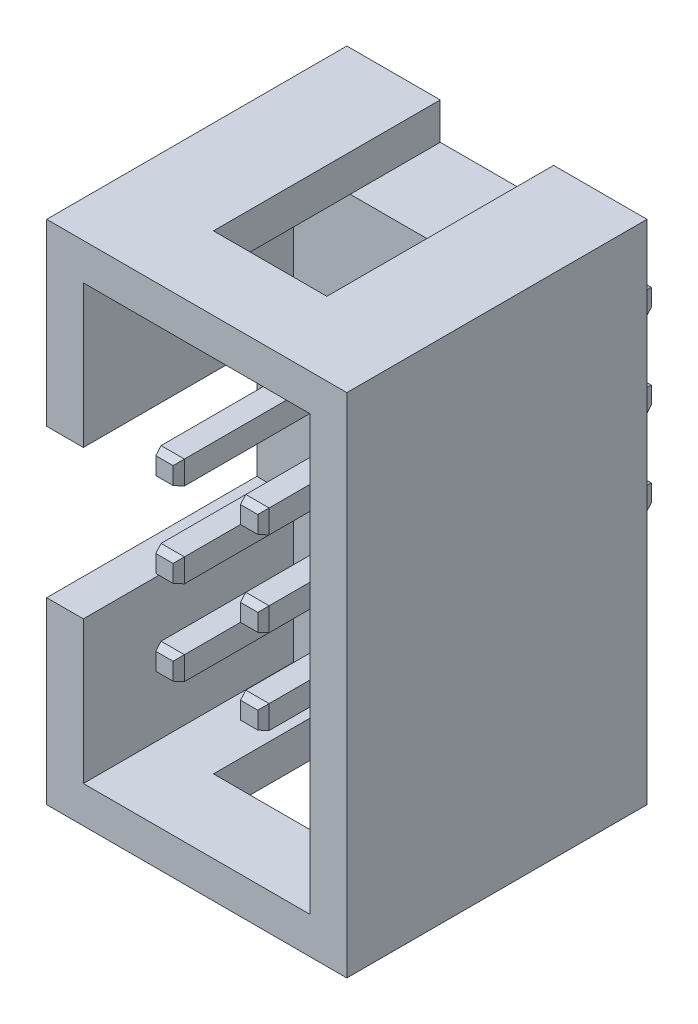
from build123d import *
from OCP.BRepFilletAPI import BRepFilletAPI_MakeChamfer

# Parameters (mm, degrees)
SKETCH1_W            = 9
SKETCH1_H            = 15.2
BOSS_EXTRUDE1_DEPTH  = 9
SKETCH2_W            = 6.8
SKETCH2_H            = 13
CUT_EXTRUDE1_DEPTH   = 6.3
SKETCH3_W            = 1.1
SKETCH3_H            = 4.45
CUT_EXTRUDE2_DEPTH   = 6.3
SKETCH4_W            = 3.4
SKETCH4_H            = 6.8
CUT_EXTRUDE3_DEPTH   = 1.1
BOSS_EXTRUDE2_START  = -5.8
SKETCH5_W            = 0.7
SKETCH5_H            = 0.7
BOSS_EXTRUDE2_DEPTH  = 11.8
LPATTERN1_COUNT      = 2
LPATTERN1_PITCH      = 2.54
LPATTERN1_COUNT_DIR2 = 3
LPATTERN1_PITCH_DIR2 = 2.54
CHAMFER1_SIZE        = 0.25
CHAMFER1_SIZE2       = 0.090992559


with BuildPart() as part:
    # Sketch1 → Boss-Extrude1 (new body)
    with BuildSketch(Plane.XY):
        Rectangle(SKETCH1_W, SKETCH1_H)
    extrude(amount=BOSS_EXTRUDE1_DEPTH)

    # Sketch2 → Cut-Extrude1 (cut)
    with BuildSketch(Plane.XY.offset(9)):
        Rectangle(SKETCH2_W, SKETCH2_H)
    extrude(amount=-CUT_EXTRUDE1_DEPTH, mode=Mode.SUBTRACT)

    # Sketch3 → Cut-Extrude2 (cut)
    with BuildSketch(Plane.XY.offset(9)):
        with Locations((-3.95, 0)):
            Rectangle(SKETCH3_W, SKETCH3_H)
    extrude(amount=-CUT_EXTRUDE2_DEPTH, mode=Mode.SUBTRACT)

    # Sketch4 → Cut-Extrude3 (cut)
    with BuildSketch(Plane.XZ.offset(7.6)):
        with Locations((0, 3.4)):
            Rectangle(SKETCH4_W, SKETCH4_H)
    cut_extrude3 = extrude(amount=-CUT_EXTRUDE3_DEPTH, mode=Mode.SUBTRACT)

    # Mirror1: Cut-Extrude3 across plane
    add(cut_extrude3.mirror(Plane.ZX), mode=Mode.SUBTRACT)

    # Sketch5 → Boss-Extrude2 (add)
    with BuildSketch(Plane.XY.offset(2.7).offset(BOSS_EXTRUDE2_START)):
        with Locations((-1.27, 2.54)):
            Rectangle(SKETCH5_W, SKETCH5_H)
    boss_extrude2 = extrude(amount=BOSS_EXTRUDE2_DEPTH)

    # LPattern1: Boss-Extrude2 2 × 3
    with Locations(*[(i * LPATTERN1_PITCH, -j * LPATTERN1_PITCH_DIR2, 0) for i in range(LPATTERN1_COUNT) for j in range(LPATTERN1_COUNT_DIR2) if (i, j) != (0, 0)]):
        add(boss_extrude2)

    # Chamfer1: one chamfer whose edges measure the first distance from different faces: ONE call of the kernel's chamfer builder (chamfer() names one face for all edges)
    chamfer1_edges_1 = [part.edges().sort_by_distance(p)[0] for p in [
        (-0.92, 0, -3.1),
    ]]
    chamfer1_side_1 = [part.faces().sort_by_distance(p)[0] for p in [
        (-0.92, 0, -1.55),
    ]]
    chamfer1_edges_2 = [part.edges().sort_by_distance(p)[0] for p in [
        (-1.27, -0.35, -3.1),
    ]]
    chamfer1_side_2 = [part.faces().sort_by_distance(p)[0] for p in [
        (-1.27, -0.35, -1.55),
    ]]
    chamfer1_edges_3 = [part.edges().sort_by_distance(p)[0] for p in [
        (-1.62, 0, -3.1),
    ]]
    chamfer1_side_3 = [part.faces().sort_by_distance(p)[0] for p in [
        (-1.62, 0, -1.55),
    ]]
    chamfer1_edges_4 = [part.edges().sort_by_distance(p)[0] for p in [
        (-1.27, 0.35, -3.1),
    ]]
    chamfer1_side_4 = [part.faces().sort_by_distance(p)[0] for p in [
        (-1.27, 0.35, -1.55),
    ]]
    chamfer1_edges_5 = [part.edges().sort_by_distance(p)[0] for p in [
        (-0.92, 0, 8.7),
    ]]
    chamfer1_side_5 = [part.faces().sort_by_distance(p)[0] for p in [
        (-0.92, 0, 5.7),
    ]]
    chamfer1_edges_6 = [part.edges().sort_by_distance(p)[0] for p in [
        (-1.27, 0.35, 8.7),
    ]]
    chamfer1_side_6 = [part.faces().sort_by_distance(p)[0] for p in [
        (-1.27, 0.35, 5.7),
    ]]
    chamfer1_edges_7 = [part.edges().sort_by_distance(p)[0] for p in [
        (-1.62, 0, 8.7),
    ]]
    chamfer1_side_7 = [part.faces().sort_by_distance(p)[0] for p in [
        (-1.62, 0, 5.7),
    ]]
    chamfer1_edges_8 = [part.edges().sort_by_distance(p)[0] for p in [
        (-1.27, -0.35, 8.7),
    ]]
    chamfer1_side_8 = [part.faces().sort_by_distance(p)[0] for p in [
        (-1.27, -0.35, 5.7),
    ]]
    chamfer1_edges_9 = [part.edges().sort_by_distance(p)[0] for p in [
        (-0.92, -2.54, -3.1),
    ]]
    chamfer1_side_9 = [part.faces().sort_by_distance(p)[0] for p in [
        (-0.92, -2.54, -1.55),
    ]]
    chamfer1_edges_10 = [part.edges().sort_by_distance(p)[0] for p in [
        (-1.27, -2.89, -3.1),
    ]]
    chamfer1_side_10 = [part.faces().sort_by_distance(p)[0] for p in [
        (-1.27, -2.89, -1.55),
    ]]
    chamfer1_edges_11 = [part.edges().sort_by_distance(p)[0] for p in [
        (-1.62, -2.54, -3.1),
    ]]
    chamfer1_side_11 = [part.faces().sort_by_distance(p)[0] for p in [
        (-1.62, -2.54, -1.55),
    ]]
    chamfer1_edges_12 = [part.edges().sort_by_distance(p)[0] for p in [
        (-1.27, -2.19, -3.1),
    ]]
    chamfer1_side_12 = [part.faces().sort_by_distance(p)[0] for p in [
        (-1.27, -2.19, -1.55),
    ]]
    chamfer1_edges_13 = [part.edges().sort_by_distance(p)[0] for p in [
        (-0.92, -2.54, 8.7),
    ]]
    chamfer1_side_13 = [part.faces().sort_by_distance(p)[0] for p in [
        (-0.92, -2.54, 5.7),
    ]]
    chamfer1_edges_14 = [part.edges().sort_by_distance(p)[0] for p in [
        (-1.27, -2.19, 8.7),
    ]]
    chamfer1_side_14 = [part.faces().sort_by_distance(p)[0] for p in [
        (-1.27, -2.19, 5.7),
    ]]
    chamfer1_edges_15 = [part.edges().sort_by_distance(p)[0] for p in [
        (-1.62, -2.54, 8.7),
    ]]
    chamfer1_side_15 = [part.faces().sort_by_distance(p)[0] for p in [
        (-1.62, -2.54, 5.7),
    ]]
    chamfer1_edges_16 = [part.edges().sort_by_distance(p)[0] for p in [
        (-1.27, -2.89, 8.7),
    ]]
    chamfer1_side_16 = [part.faces().sort_by_distance(p)[0] for p in [
        (-1.27, -2.89, 5.7),
    ]]
    chamfer1_edges_17 = [part.edges().sort_by_distance(p)[0] for p in [
        (1.62, 2.54, -3.1),
    ]]
    chamfer1_side_17 = [part.faces().sort_by_distance(p)[0] for p in [
        (1.62, 2.54, -1.55),
    ]]
    chamfer1_edges_18 = [part.edges().sort_by_distance(p)[0] for p in [
        (1.27, 2.19, -3.1),
    ]]
    chamfer1_side_18 = [part.faces().sort_by_distance(p)[0] for p in [
        (1.27, 2.19, -1.55),
    ]]
    chamfer1_edges_19 = [part.edges().sort_by_distance(p)[0] for p in [
        (0.92, 2.54, -3.1),
    ]]
    chamfer1_side_19 = [part.faces().sort_by_distance(p)[0] for p in [
        (0.92, 2.54, -1.55),
    ]]
    chamfer1_edges_20 = [part.edges().sort_by_distance(p)[0] for p in [
        (1.27, 2.89, -3.1),
    ]]
    chamfer1_side_20 = [part.faces().sort_by_distance(p)[0] for p in [
        (1.27, 2.89, -1.55),
    ]]
    chamfer1_edges_21 = [part.edges().sort_by_distance(p)[0] for p in [
        (1.62, 2.54, 8.7),
    ]]
    chamfer1_side_21 = [part.faces().sort_by_distance(p)[0] for p in [
        (1.62, 2.54, 5.7),
    ]]
    chamfer1_edges_22 = [part.edges().sort_by_distance(p)[0] for p in [
        (1.27, 2.89, 8.7),
    ]]
    chamfer1_side_22 = [part.faces().sort_by_distance(p)[0] for p in [
        (1.27, 2.89, 5.7),
    ]]
    chamfer1_edges_23 = [part.edges().sort_by_distance(p)[0] for p in [
        (0.92, 2.54, 8.7),
    ]]
    chamfer1_side_23 = [part.faces().sort_by_distance(p)[0] for p in [
        (0.92, 2.54, 5.7),
    ]]
    chamfer1_edges_24 = [part.edges().sort_by_distance(p)[0] for p in [
        (1.27, 2.19, 8.7),
    ]]
    chamfer1_side_24 = [part.faces().sort_by_distance(p)[0] for p in [
        (1.27, 2.19, 5.7),
    ]]
    chamfer1_edges_25 = [part.edges().sort_by_distance(p)[0] for p in [
        (1.62, 0, -3.1),
    ]]
    chamfer1_side_25 = [part.faces().sort_by_distance(p)[0] for p in [
        (1.62, 0, -1.55),
    ]]
    chamfer1_edges_26 = [part.edges().sort_by_distance(p)[0] for p in [
        (1.27, -0.35, -3.1),
    ]]
    chamfer1_side_26 = [part.faces().sort_by_distance(p)[0] for p in [
        (1.27, -0.35, -1.55),
    ]]
    chamfer1_edges_27 = [part.edges().sort_by_distance(p)[0] for p in [
        (0.92, 0, -3.1),
    ]]
    chamfer1_side_27 = [part.faces().sort_by_distance(p)[0] for p in [
        (0.92, 0, -1.55),
    ]]
    chamfer1_edges_28 = [part.edges().sort_by_distance(p)[0] for p in [
        (1.27, 0.35, -3.1),
    ]]
    chamfer1_side_28 = [part.faces().sort_by_distance(p)[0] for p in [
        (1.27, 0.35, -1.55),
    ]]
    chamfer1_edges_29 = [part.edges().sort_by_distance(p)[0] for p in [
        (1.62, 0, 8.7),
    ]]
    chamfer1_side_29 = [part.faces().sort_by_distance(p)[0] for p in [
        (1.62, 0, 5.7),
    ]]
    chamfer1_edges_30 = [part.edges().sort_by_distance(p)[0] for p in [
        (1.27, 0.35, 8.7),
    ]]
    chamfer1_side_30 = [part.faces().sort_by_distance(p)[0] for p in [
        (1.27, 0.35, 5.7),
    ]]
    chamfer1_edges_31 = [part.edges().sort_by_distance(p)[0] for p in [
        (0.92, 0, 8.7),
    ]]
    chamfer1_side_31 = [part.faces().sort_by_distance(p)[0] for p in [
        (0.92, 0, 5.7),
    ]]
    chamfer1_edges_32 = [part.edges().sort_by_distance(p)[0] for p in [
        (1.27, -0.35, 8.7),
    ]]
    chamfer1_side_32 = [part.faces().sort_by_distance(p)[0] for p in [
        (1.27, -0.35, 5.7),
    ]]
    chamfer1_edges_33 = [part.edges().sort_by_distance(p)[0] for p in [
        (1.62, -2.54, -3.1),
    ]]
    chamfer1_side_33 = [part.faces().sort_by_distance(p)[0] for p in [
        (1.62, -2.54, -1.55),
    ]]
    chamfer1_edges_34 = [part.edges().sort_by_distance(p)[0] for p in [
        (1.27, -2.89, -3.1),
    ]]
    chamfer1_side_34 = [part.faces().sort_by_distance(p)[0] for p in [
        (1.27, -2.89, -1.55),
    ]]
    chamfer1_edges_35 = [part.edges().sort_by_distance(p)[0] for p in [
        (0.92, -2.54, -3.1),
    ]]
    chamfer1_side_35 = [part.faces().sort_by_distance(p)[0] for p in [
        (0.92, -2.54, -1.55),
    ]]
    chamfer1_edges_36 = [part.edges().sort_by_distance(p)[0] for p in [
        (1.27, -2.19, -3.1),
    ]]
    chamfer1_side_36 = [part.faces().sort_by_distance(p)[0] for p in [
        (1.27, -2.19, -1.55),
    ]]
    chamfer1_edges_37 = [part.edges().sort_by_distance(p)[0] for p in [
        (1.62, -2.54, 8.7),
    ]]
    chamfer1_side_37 = [part.faces().sort_by_distance(p)[0] for p in [
        (1.62, -2.54, 5.7),
    ]]
    chamfer1_edges_38 = [part.edges().sort_by_distance(p)[0] for p in [
        (1.27, -2.19, 8.7),
    ]]
    chamfer1_side_38 = [part.faces().sort_by_distance(p)[0] for p in [
        (1.27, -2.19, 5.7),
    ]]
    chamfer1_edges_39 = [part.edges().sort_by_distance(p)[0] for p in [
        (0.92, -2.54, 8.7),
    ]]
    chamfer1_side_39 = [part.faces().sort_by_distance(p)[0] for p in [
        (0.92, -2.54, 5.7),
    ]]
    chamfer1_edges_40 = [part.edges().sort_by_distance(p)[0] for p in [
        (1.27, -2.89, 8.7),
    ]]
    chamfer1_side_40 = [part.faces().sort_by_distance(p)[0] for p in [
        (1.27, -2.89, 5.7),
    ]]
    chamfer1_edges_41 = [part.edges().sort_by_distance(p)[0] for p in [
        (-0.92, 2.54, -3.1),
    ]]
    chamfer1_side_41 = [part.faces().sort_by_distance(p)[0] for p in [
        (-0.92, 2.54, -1.55),
    ]]
    chamfer1_edges_42 = [part.edges().sort_by_distance(p)[0] for p in [
        (-1.27, 2.19, -3.1),
    ]]
    chamfer1_side_42 = [part.faces().sort_by_distance(p)[0] for p in [
        (-1.27, 2.19, -1.55),
    ]]
    chamfer1_edges_43 = [part.edges().sort_by_distance(p)[0] for p in [
        (-1.62, 2.54, -3.1),
    ]]
    chamfer1_side_43 = [part.faces().sort_by_distance(p)[0] for p in [
        (-1.62, 2.54, -1.55),
    ]]
    chamfer1_edges_44 = [part.edges().sort_by_distance(p)[0] for p in [
        (-1.27, 2.89, -3.1),
    ]]
    chamfer1_side_44 = [part.faces().sort_by_distance(p)[0] for p in [
        (-1.27, 2.89, -1.55),
    ]]
    chamfer1_edges_45 = [part.edges().sort_by_distance(p)[0] for p in [
        (-0.92, 2.54, 8.7),
    ]]
    chamfer1_side_45 = [part.faces().sort_by_distance(p)[0] for p in [
        (-0.92, 2.54, 5.7),
    ]]
    chamfer1_edges_46 = [part.edges().sort_by_distance(p)[0] for p in [
        (-1.27, 2.89, 8.7),
    ]]
    chamfer1_side_46 = [part.faces().sort_by_distance(p)[0] for p in [
        (-1.27, 2.89, 5.7),
    ]]
    chamfer1_edges_47 = [part.edges().sort_by_distance(p)[0] for p in [
        (-1.62, 2.54, 8.7),
    ]]
    chamfer1_side_47 = [part.faces().sort_by_distance(p)[0] for p in [
        (-1.62, 2.54, 5.7),
    ]]
    chamfer1_edges_48 = [part.edges().sort_by_distance(p)[0] for p in [
        (-1.27, 2.19, 8.7),
    ]]
    chamfer1_side_48 = [part.faces().sort_by_distance(p)[0] for p in [
        (-1.27, 2.19, 5.7),
    ]]
    chamfer1 = BRepFilletAPI_MakeChamfer(part.part.solid().wrapped)
    for e in chamfer1_edges_1:
        chamfer1.Add(CHAMFER1_SIZE, CHAMFER1_SIZE2, e.wrapped, chamfer1_side_1[0].wrapped)  # the first distance lies on this face
    for e in chamfer1_edges_2:
        chamfer1.Add(CHAMFER1_SIZE, CHAMFER1_SIZE2, e.wrapped, chamfer1_side_2[0].wrapped)  # the first distance lies on this face
    for e in chamfer1_edges_3:
        chamfer1.Add(CHAMFER1_SIZE, CHAMFER1_SIZE2, e.wrapped, chamfer1_side_3[0].wrapped)  # the first distance lies on this face
    for e in chamfer1_edges_4:
        chamfer1.Add(CHAMFER1_SIZE, CHAMFER1_SIZE2, e.wrapped, chamfer1_side_4[0].wrapped)  # the first distance lies on this face
    for e in chamfer1_edges_5:
        chamfer1.Add(CHAMFER1_SIZE, CHAMFER1_SIZE2, e.wrapped, chamfer1_side_5[0].wrapped)  # the first distance lies on this face
    for e in chamfer1_edges_6:
        chamfer1.Add(CHAMFER1_SIZE, CHAMFER1_SIZE2, e.wrapped, chamfer1_side_6[0].wrapped)  # the first distance lies on this face
    for e in chamfer1_edges_7:
        chamfer1.Add(CHAMFER1_SIZE, CHAMFER1_SIZE2, e.wrapped, chamfer1_side_7[0].wrapped)  # the first distance lies on this face
    for e in chamfer1_edges_8:
        chamfer1.Add(CHAMFER1_SIZE, CHAMFER1_SIZE2, e.wrapped, chamfer1_side_8[0].wrapped)  # the first distance lies on this face
    for e in chamfer1_edges_9:
        chamfer1.Add(CHAMFER1_SIZE, CHAMFER1_SIZE2, e.wrapped, chamfer1_side_9[0].wrapped)  # the first distance lies on this face
    for e in chamfer1_edges_10:
        chamfer1.Add(CHAMFER1_SIZE, CHAMFER1_SIZE2, e.wrapped, chamfer1_side_10[0].wrapped)  # the first distance lies on this face
    for e in chamfer1_edges_11:
        chamfer1.Add(CHAMFER1_SIZE, CHAMFER1_SIZE2, e.wrapped, chamfer1_side_11[0].wrapped)  # the first distance lies on this face
    for e in chamfer1_edges_12:
        chamfer1.Add(CHAMFER1_SIZE, CHAMFER1_SIZE2, e.wrapped, chamfer1_side_12[0].wrapped)  # the first distance lies on this face
    for e in chamfer1_edges_13:
        chamfer1.Add(CHAMFER1_SIZE, CHAMFER1_SIZE2, e.wrapped, chamfer1_side_13[0].wrapped)  # the first distance lies on this face
    for e in chamfer1_edges_14:
        chamfer1.Add(CHAMFER1_SIZE, CHAMFER1_SIZE2, e.wrapped, chamfer1_side_14[0].wrapped)  # the first distance lies on this face
    for e in chamfer1_edges_15:
        chamfer1.Add(CHAMFER1_SIZE, CHAMFER1_SIZE2, e.wrapped, chamfer1_side_15[0].wrapped)  # the first distance lies on this face
    for e in chamfer1_edges_16:
        chamfer1.Add(CHAMFER1_SIZE, CHAMFER1_SIZE2, e.wrapped, chamfer1_side_16[0].wrapped)  # the first distance lies on this face
    for e in chamfer1_edges_17:
        chamfer1.Add(CHAMFER1_SIZE, CHAMFER1_SIZE2, e.wrapped, chamfer1_side_17[0].wrapped)  # the first distance lies on this face
    for e in chamfer1_edges_18:
        chamfer1.Add(CHAMFER1_SIZE, CHAMFER1_SIZE2, e.wrapped, chamfer1_side_18[0].wrapped)  # the first distance lies on this face
    for e in chamfer1_edges_19:
        chamfer1.Add(CHAMFER1_SIZE, CHAMFER1_SIZE2, e.wrapped, chamfer1_side_19[0].wrapped)  # the first distance lies on this face
    for e in chamfer1_edges_20:
        chamfer1.Add(CHAMFER1_SIZE, CHAMFER1_SIZE2, e.wrapped, chamfer1_side_20[0].wrapped)  # the first distance lies on this face
    for e in chamfer1_edges_21:
        chamfer1.Add(CHAMFER1_SIZE, CHAMFER1_SIZE2, e.wrapped, chamfer1_side_21[0].wrapped)  # the first distance lies on this face
    for e in chamfer1_edges_22:
        chamfer1.Add(CHAMFER1_SIZE, CHAMFER1_SIZE2, e.wrapped, chamfer1_side_22[0].wrapped)  # the first distance lies on this face
    for e in chamfer1_edges_23:
        chamfer1.Add(CHAMFER1_SIZE, CHAMFER1_SIZE2, e.wrapped, chamfer1_side_23[0].wrapped)  # the first distance lies on this face
    for e in chamfer1_edges_24:
        chamfer1.Add(CHAMFER1_SIZE, CHAMFER1_SIZE2, e.wrapped, chamfer1_side_24[0].wrapped)  # the first distance lies on this face
    for e in chamfer1_edges_25:
        chamfer1.Add(CHAMFER1_SIZE, CHAMFER1_SIZE2, e.wrapped, chamfer1_side_25[0].wrapped)  # the first distance lies on this face
    for e in chamfer1_edges_26:
        chamfer1.Add(CHAMFER1_SIZE, CHAMFER1_SIZE2, e.wrapped, chamfer1_side_26[0].wrapped)  # the first distance lies on this face
    for e in chamfer1_edges_27:
        chamfer1.Add(CHAMFER1_SIZE, CHAMFER1_SIZE2, e.wrapped, chamfer1_side_27[0].wrapped)  # the first distance lies on this face
    for e in chamfer1_edges_28:
        chamfer1.Add(CHAMFER1_SIZE, CHAMFER1_SIZE2, e.wrapped, chamfer1_side_28[0].wrapped)  # the first distance lies on this face
    for e in chamfer1_edges_29:
        chamfer1.Add(CHAMFER1_SIZE, CHAMFER1_SIZE2, e.wrapped, chamfer1_side_29[0].wrapped)  # the first distance lies on this face
    for e in chamfer1_edges_30:
        chamfer1.Add(CHAMFER1_SIZE, CHAMFER1_SIZE2, e.wrapped, chamfer1_side_30[0].wrapped)  # the first distance lies on this face
    for e in chamfer1_edges_31:
        chamfer1.Add(CHAMFER1_SIZE, CHAMFER1_SIZE2, e.wrapped, chamfer1_side_31[0].wrapped)  # the first distance lies on this face
    for e in chamfer1_edges_32:
        chamfer1.Add(CHAMFER1_SIZE, CHAMFER1_SIZE2, e.wrapped, chamfer1_side_32[0].wrapped)  # the first distance lies on this face
    for e in chamfer1_edges_33:
        chamfer1.Add(CHAMFER1_SIZE, CHAMFER1_SIZE2, e.wrapped, chamfer1_side_33[0].wrapped)  # the first distance lies on this face
    for e in chamfer1_edges_34:
        chamfer1.Add(CHAMFER1_SIZE, CHAMFER1_SIZE2, e.wrapped, chamfer1_side_34[0].wrapped)  # the first distance lies on this face
    for e in chamfer1_edges_35:
        chamfer1.Add(CHAMFER1_SIZE, CHAMFER1_SIZE2, e.wrapped, chamfer1_side_35[0].wrapped)  # the first distance lies on this face
    for e in chamfer1_edges_36:
        chamfer1.Add(CHAMFER1_SIZE, CHAMFER1_SIZE2, e.wrapped, chamfer1_side_36[0].wrapped)  # the first distance lies on this face
    for e in chamfer1_edges_37:
        chamfer1.Add(CHAMFER1_SIZE, CHAMFER1_SIZE2, e.wrapped, chamfer1_side_37[0].wrapped)  # the first distance lies on this face
    for e in chamfer1_edges_38:
        chamfer1.Add(CHAMFER1_SIZE, CHAMFER1_SIZE2, e.wrapped, chamfer1_side_38[0].wrapped)  # the first distance lies on this face
    for e in chamfer1_edges_39:
        chamfer1.Add(CHAMFER1_SIZE, CHAMFER1_SIZE2, e.wrapped, chamfer1_side_39[0].wrapped)  # the first distance lies on this face
    for e in chamfer1_edges_40:
        chamfer1.Add(CHAMFER1_SIZE, CHAMFER1_SIZE2, e.wrapped, chamfer1_side_40[0].wrapped)  # the first distance lies on this face
    for e in chamfer1_edges_41:
        chamfer1.Add(CHAMFER1_SIZE, CHAMFER1_SIZE2, e.wrapped, chamfer1_side_41[0].wrapped)  # the first distance lies on this face
    for e in chamfer1_edges_42:
        chamfer1.Add(CHAMFER1_SIZE, CHAMFER1_SIZE2, e.wrapped, chamfer1_side_42[0].wrapped)  # the first distance lies on this face
    for e in chamfer1_edges_43:
        chamfer1.Add(CHAMFER1_SIZE, CHAMFER1_SIZE2, e.wrapped, chamfer1_side_43[0].wrapped)  # the first distance lies on this face
    for e in chamfer1_edges_44:
        chamfer1.Add(CHAMFER1_SIZE, CHAMFER1_SIZE2, e.wrapped, chamfer1_side_44[0].wrapped)  # the first distance lies on this face
    for e in chamfer1_edges_45:
        chamfer1.Add(CHAMFER1_SIZE, CHAMFER1_SIZE2, e.wrapped, chamfer1_side_45[0].wrapped)  # the first distance lies on this face
    for e in chamfer1_edges_46:
        chamfer1.Add(CHAMFER1_SIZE, CHAMFER1_SIZE2, e.wrapped, chamfer1_side_46[0].wrapped)  # the first distance lies on this face
    for e in chamfer1_edges_47:
        chamfer1.Add(CHAMFER1_SIZE, CHAMFER1_SIZE2, e.wrapped, chamfer1_side_47[0].wrapped)  # the first distance lies on this face
    for e in chamfer1_edges_48:
        chamfer1.Add(CHAMFER1_SIZE, CHAMFER1_SIZE2, e.wrapped, chamfer1_side_48[0].wrapped)  # the first distance lies on this face
    add(Compound.cast(chamfer1.Shape()), mode=Mode.REPLACE)


solid = part.part
